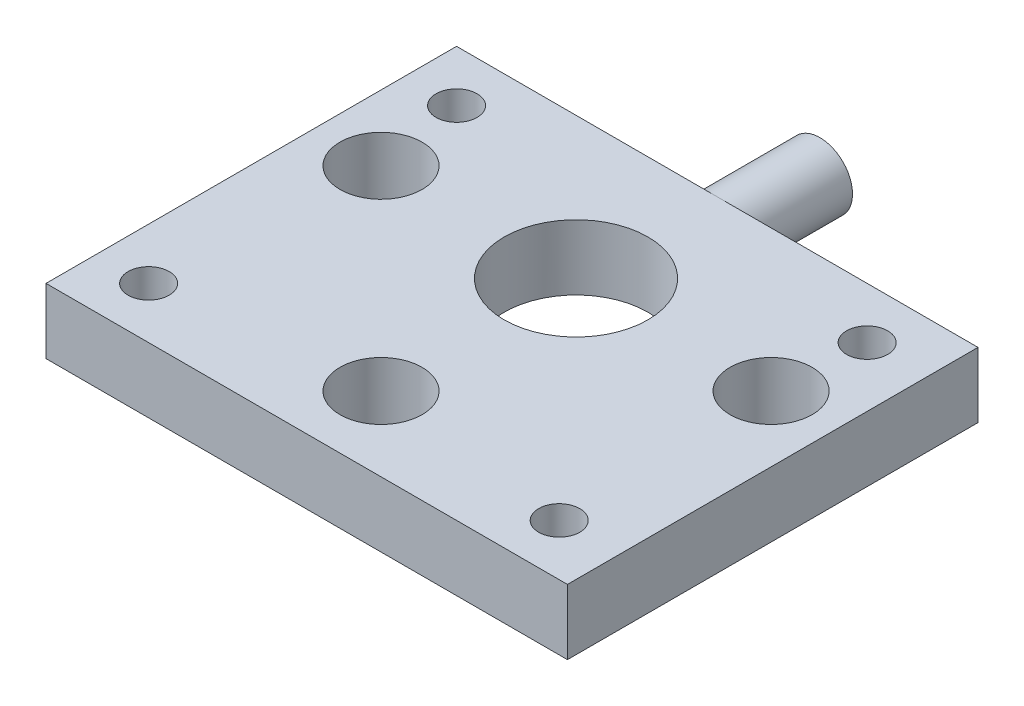
from build123d import *

# Parameters (mm, degrees)
CROQUIS1_W              = 50.8
CROQUIS1_H              = 80
SALIENTE_EXTRUIR1_DEPTH = 6.35
CROQUIS4_R              = 4
CORTAR_EXTRUIR3_DEPTH   = 48.806720239
CROQUIS5_W              = 50.8
CROQUIS5_H              = 12.7
CORTAR_EXTRUIR4_DEPTH   = 48.806720239
CROQUIS6_W              = 50.8
CROQUIS6_H              = 20.526572449
CORTAR_EXTRUIR5_DEPTH   = 10
CROQUIS7_W              = 50.8
CROQUIS7_H              = 6.773427551
CORTAR_EXTRUIR6_DEPTH   = 10
CROQUIS8_R              = 3.175
SALIENTE_EXTRUIR2_DEPTH = 10
CROQUIS9_R              = 7
CORTAR_EXTRUIR7_DEPTH   = 10
CROQUIS10_R             = 2
CORTAR_EXTRUIR8_DEPTH   = 10


with BuildPart() as part:
    # Croquis1 → Saliente-Extruir1 (new body)
    with BuildSketch(Plane(origin=(0, 0, 0), x_dir=(1, 0, 0), z_dir=(0, 1, 0))):
        Rectangle(CROQUIS1_W, CROQUIS1_H)
    extrude(amount=SALIENTE_EXTRUIR1_DEPTH)

    # Croquis4 → Cortar-Extruir3 (cut, through all)
    with BuildSketch(Plane(origin=(0, 6.35, 0), x_dir=(1, 0, 0), z_dir=(0, 1, 0))):
        with Locations(Location((-19, 19.466091849, 0), (0, 0, 270))):
            Circle(CROQUIS4_R)
        with Locations(Location((19, 19.466091849, 0), (0, 0, 270))):
            Circle(CROQUIS4_R)
        with Locations(Location((0, 0.466091849, 0), (0, 0, 270))):
            Circle(CROQUIS4_R)
    extrude(amount=-CORTAR_EXTRUIR3_DEPTH, mode=Mode.SUBTRACT)

    # Croquis5 → Cortar-Extruir4 (cut, through all)
    with BuildSketch(Plane(origin=(0, 6.35, 0), x_dir=(1, 0, 0), z_dir=(0, 1, 0))):
        with Locations((0, -33.65)):
            Rectangle(CROQUIS5_W, CROQUIS5_H)
    extrude(amount=-CORTAR_EXTRUIR4_DEPTH, mode=Mode.SUBTRACT)

    # Croquis6 → Cortar-Extruir5 (cut)
    with BuildSketch(Plane(origin=(0, 6.35, 0), x_dir=(1, 0, 0), z_dir=(0, 1, 0))):
        with Locations((0, -17.036713776)):
            Rectangle(CROQUIS6_W, CROQUIS6_H)
    extrude(amount=-CORTAR_EXTRUIR5_DEPTH, mode=Mode.SUBTRACT)

    # Croquis7 → Cortar-Extruir6 (cut)
    with BuildSketch(Plane.XZ):
        with Locations((0, -36.613286225)):
            Rectangle(CROQUIS7_W, CROQUIS7_H)
    extrude(amount=-CORTAR_EXTRUIR6_DEPTH, mode=Mode.SUBTRACT)

    # Croquis8 → Saliente-Extruir2 (add)
    with BuildSketch(Plane(origin=(0, 0, -33.226572449), x_dir=(-1, 0, 0), z_dir=(0, 0, -1))):
        with Locations(Location((0, 3.175, 0), (0, 0, 270))):
            Circle(CROQUIS8_R)
    extrude(amount=SALIENTE_EXTRUIR2_DEPTH)

    # Croquis9 → Cortar-Extruir7 (cut)
    with BuildSketch(Plane.XZ):
        with Locations(Location((0, -19.466091849, 0), (0, 0, 270))):
            Circle(CROQUIS9_R)
    extrude(amount=-CORTAR_EXTRUIR7_DEPTH, mode=Mode.SUBTRACT)

    # Croquis10 → Cortar-Extruir8 (cut)
    with BuildSketch(Plane.XZ):
        with Locations(Location((-20.4, 1.773427551, 0), (0, 0, 270))):
            Circle(CROQUIS10_R)
        with Locations(Location((19.6, 1.773427551, 0), (0, 0, 270))):
            Circle(CROQUIS10_R)
        with Locations(Location((19.6, -28.226572449, 0), (0, 0, 270))):
            Circle(CROQUIS10_R)
        with Locations(Location((-20.4, -28.226572449, 0), (0, 0, 270))):
            Circle(CROQUIS10_R)
    extrude(amount=-CORTAR_EXTRUIR8_DEPTH, mode=Mode.SUBTRACT)


solid = part.part
